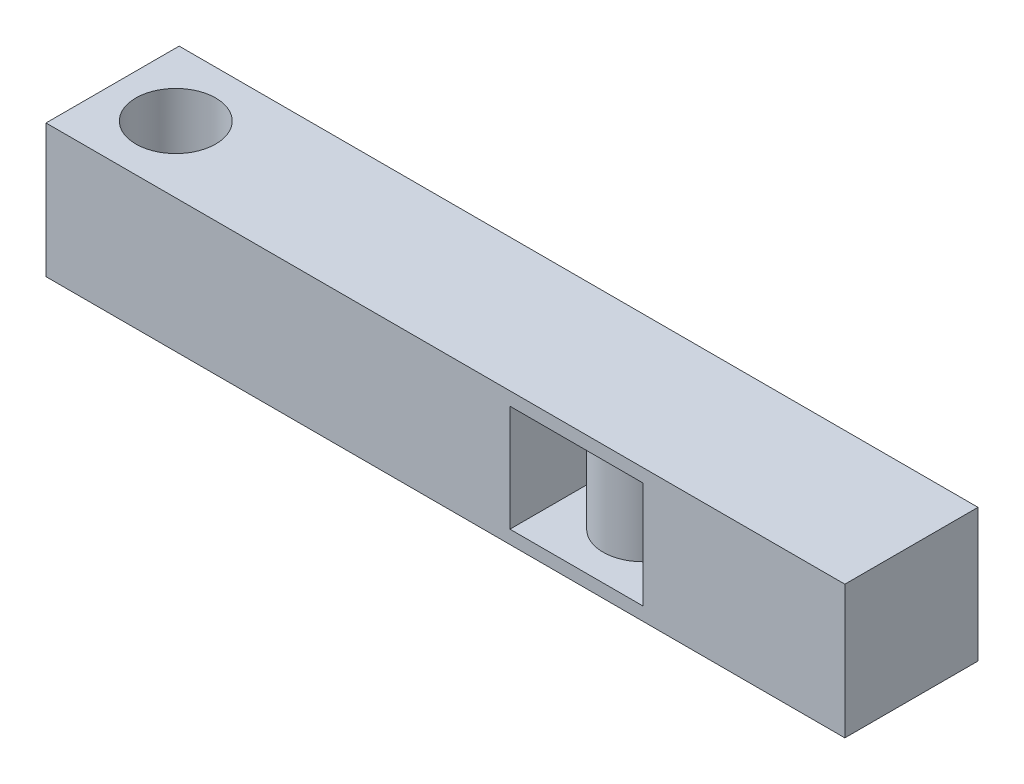
from build123d import *

# Parameters (mm, degrees)
SKETCH1_W               = 300
SKETCH1_H               = 50
BOSS_EXTRUDE1_DEPTH     = 50
CUT_EXTRUDE1_DEPTH      = 166.831239518
CUT_EXTRUDE1_DEPTH_BACK = 166.831239518
SKETCH2_R               = 15
CUT_EXTRUDE2_START      = -5
SKETCH3_W               = 50
SKETCH3_H               = 50
CUT_EXTRUDE2_DEPTH      = 40
BOSS_EXTRUDE2_REACH     = 166.393
SKETCH4_R               = 15


with BuildPart() as part:
    # Sketch1 → Boss-Extrude1 (new body)
    with BuildSketch(Plane.XY):
        Rectangle(SKETCH1_W, SKETCH1_H)
    extrude(amount=BOSS_EXTRUDE1_DEPTH)

    # Sketch2 → Cut-Extrude1 (cut, two sides: drawn at the far end of the back side and taken through both)
    with BuildSketch(Plane(origin=(0, 25, 0), x_dir=(1, 0, 0), z_dir=(0, 1, 0)).offset(-CUT_EXTRUDE1_DEPTH_BACK)):
        with Locations(Location((-126.266078419, -25, 0), (0, 0, 270))):
            Circle(SKETCH2_R)
    extrude(amount=CUT_EXTRUDE1_DEPTH + CUT_EXTRUDE1_DEPTH_BACK, mode=Mode.SUBTRACT)

    # Sketch3 → Cut-Extrude2 (cut)
    with BuildSketch(Plane(origin=(0, 25, 0), x_dir=(1, 0, 0), z_dir=(0, 1, 0)).offset(CUT_EXTRUDE2_START)):
        with Locations((49.233921581, -25)):
            Rectangle(SKETCH3_W, SKETCH3_H)
    extrude(amount=-CUT_EXTRUDE2_DEPTH, mode=Mode.SUBTRACT)

    # Sketch4 → Boss-Extrude2 (add, up to next)
    with BuildSketch(Plane(origin=(0, -20, 0), x_dir=(1, 0, 0), z_dir=(0, 1, 0)), mode=Mode.PRIVATE) as boss_extrude2_sk1:
        with Locations(Location((49.233921581, -25, 0), (0, 0, 90))):
            Circle(SKETCH4_R)
    boss_extrude2_tool1 = extrude(boss_extrude2_sk1.sketch, amount=BOSS_EXTRUDE2_REACH, mode=Mode.PRIVATE) - part.part
    add(boss_extrude2_tool1.solids().sort_by_distance((49.233922, -20, 25))[0])


solid = part.part
